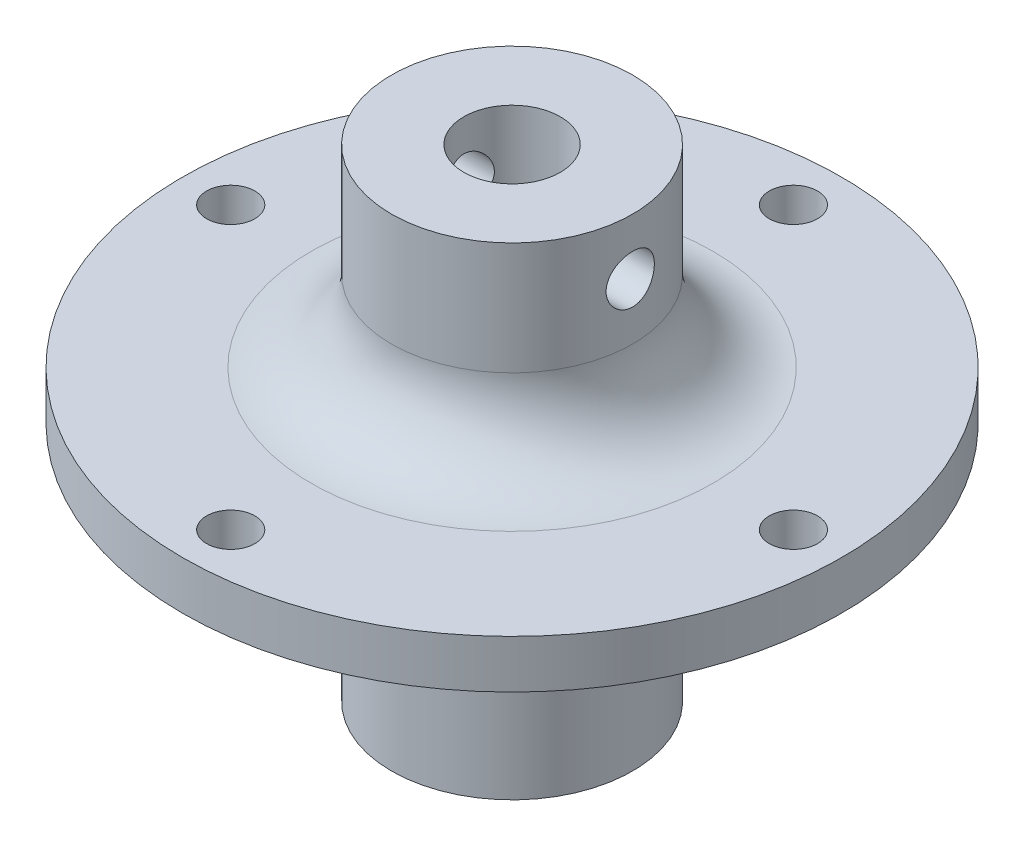
from build123d import *

# Parameters (mm, degrees)
FILLET1_R               = 5
SKETCH3_R               = 1.5
CUT_EXTRUDE2_DEPTH      = 35.124771062
CUT_EXTRUDE3_DEPTH      = 46.872104813
CUT_EXTRUDE3_DEPTH_BACK = 46.872104813


with BuildPart() as part:
    # Sketch2 → Revolve1 (revolve)
    with BuildSketch(Plane.XY, mode=Mode.PRIVATE) as revolve1_sk:
        Polygon((7.5, 30), (7.5, 18), (20.5, 18), (20.5, 15), (7.5, 15), (7.5, 0), (3, 0), (3, 30), align=None)
    revolve(revolve1_sk.sketch.rotate(Axis((0, 9.767689721, 0), (0, -1, 0)), 90), axis=Axis((0, 9.767689721, 0), (0, -1, 0)))

    # Fillet1
    fillet1_edges = [part.edges().sort_by_distance(p)[0] for p in [
        (0, 18, -7.5),
    ]]
    fillet(fillet1_edges, radius=FILLET1_R)

    # Sketch3 → Cut-Extrude2 (cut, through all)
    with BuildSketch(Plane(origin=(0, 18, 0), x_dir=(1, 0, 0), z_dir=(0, 1, 0))):
        with Locations(Location((0, 17.5, 0), (0, 0, 270))):
            Circle(SKETCH3_R)
        with Locations(Location((17.5, 0, 0), (0, 0, 270))):
            Circle(SKETCH3_R)
        with Locations(Location((0, -17.5, 0), (0, 0, 270))):
            Circle(SKETCH3_R)
        with Locations(Location((-17.5, 0, 0), (0, 0, 270))):
            Circle(SKETCH3_R)
    extrude(amount=-CUT_EXTRUDE2_DEPTH, mode=Mode.SUBTRACT)

    # Sketch4 → Cut-Extrude3 (cut, two sides: drawn at the far end of the back side and taken through both)
    with BuildSketch(Plane.ZY.offset(7.5).offset(-CUT_EXTRUDE3_DEPTH_BACK)):
        with BuildLine():
            ThreePointArc((1.5, 26.5), (0.324875311, 27.964396132), (-1.35927471, 27.134328198))
            Line((-1.35927471, 27.134328198), (1.35927471, 25.865671802))
            ThreePointArc((1.35927471, 25.865671802), (1.464396132, 26.175124689), (1.5, 26.5))
        make_face()
        with BuildLine():
            Line((1.35927471, 25.865671802), (-1.35927471, 27.134328198))
            ThreePointArc((-1.35927471, 27.134328198), (-0.634328198, 25.14072529), (1.35927471, 25.865671802))
        make_face()
    extrude(amount=CUT_EXTRUDE3_DEPTH + CUT_EXTRUDE3_DEPTH_BACK, mode=Mode.SUBTRACT)


solid = part.part
